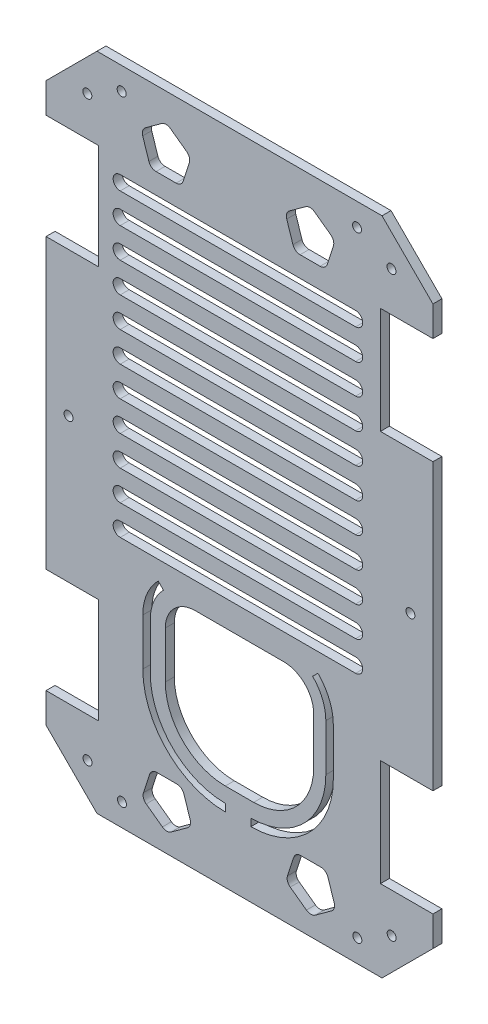
from build123d import *

# Parameters (mm, degrees)
SKETCH1_R           = 3
BOSS_EXTRUDE1_DEPTH = 6


with BuildPart() as part:
    # Sketch1 → Boss-Extrude1 (new body)
    with BuildSketch(Plane.XY):
        Polygon((-95, 220), (-128.941125497, 186.058874503), (-128.941125497, 166.058874503), (-93.941125497, 166.058874503), (-93.941125497, 96.058874503), (-128.941125497, 96.058874503), (-128.941125497, -96.058874503), (-93.941125497, -96.058874503), (-93.941125497, -166.058874503), (-128.941125497, -166.058874503), (-128.941125497, -186.058874503), (-95, -220), (95, -220), (128.941125497, -186.058874503), (128.941125497, -166.058874503), (93.941125497, -166.058874503), (93.941125497, -95), (128.941125497, -95), (128.941125497, 95), (93.941125497, 95), (93.941125497, 166.058874503), (128.941125497, 166.058874503), (128.941125497, 186.058874503), (95, 220), align=None)
        with Locations((-101.293979907, -192.492816657)):
            Circle(SKETCH1_R, mode=Mode.SUBTRACT)
        with Locations((-78.553968254, 205)):
            Circle(SKETCH1_R, mode=Mode.SUBTRACT)
        with Locations((-113.941125497, 0)):
            Circle(SKETCH1_R, mode=Mode.SUBTRACT)
        with Locations((-78.346031746, -205)):
            Circle(SKETCH1_R, mode=Mode.SUBTRACT)
        with Locations((78.553968254, -205)):
            Circle(SKETCH1_R, mode=Mode.SUBTRACT)
        with Locations((101.433942154, -192.35285441)):
            Circle(SKETCH1_R, mode=Mode.SUBTRACT)
        with Locations((113.941125497, 0)):
            Circle(SKETCH1_R, mode=Mode.SUBTRACT)
        with Locations((101.293979907, 192.492816657)):
            Circle(SKETCH1_R, mode=Mode.SUBTRACT)
        with Locations((78.346031746, 205)):
            Circle(SKETCH1_R, mode=Mode.SUBTRACT)
        with Locations((-101.433942154, 192.35285441)):
            Circle(SKETCH1_R, mode=Mode.SUBTRACT)
        with BuildLine():
            Line((-29.457020152, -70.183029421), (29.457020152, -70.183029421))
            ThreePointArc((29.457020152, -70.183029421), (43.599155776, -76.040893798), (49.457020152, -90.183029421))
            Line((49.457020152, -90.183029421), (49.457020152, -121.389619945))
            ThreePointArc((49.457020152, -121.389619945), (37.741291399, -149.673891193), (9.457020152, -161.389619945))
            Line((9.457020152, -161.389619945), (-9.457020152, -161.389619945))
            ThreePointArc((-9.457020152, -161.389619945), (-37.741291399, -149.673891193), (-49.457020152, -121.389619945))
            Line((-49.457020152, -121.389619945), (-49.457020152, -90.183029421))
            ThreePointArc((-49.457020152, -90.183029421), (-43.599155776, -76.040893798), (-29.457020152, -70.183029421))
        make_face(mode=Mode.SUBTRACT)
        with BuildLine():
            Line((-79.510988406, 156.534997535), (77.389011594, 156.534997535))
            ThreePointArc((77.389011594, 156.534997535), (82.10898008, 151.81502905), (77.389011594, 147.095060565))
            Line((77.389011594, 147.095060565), (-79.510988406, 147.095060565))
            ThreePointArc((-79.510988406, 147.095060565), (-84.230956891, 151.81502905), (-79.510988406, 156.534997535))
        make_face(mode=Mode.SUBTRACT)
        with BuildLine():
            Line((-79.510988406, 136.534997535), (77.389011594, 136.534997535))
            ThreePointArc((77.389011594, 136.534997535), (82.10898008, 131.81502905), (77.389011594, 127.095060565))
            Line((77.389011594, 127.095060565), (-79.510988406, 127.095060565))
            ThreePointArc((-79.510988406, 127.095060565), (-84.230956891, 131.81502905), (-79.510988406, 136.534997535))
        make_face(mode=Mode.SUBTRACT)
        with BuildLine():
            Line((-79.510988406, 116.534997535), (77.389011594, 116.534997535))
            ThreePointArc((77.389011594, 116.534997535), (82.10898008, 111.81502905), (77.389011594, 107.095060565))
            Line((77.389011594, 107.095060565), (-79.510988406, 107.095060565))
            ThreePointArc((-79.510988406, 107.095060565), (-84.230956891, 111.81502905), (-79.510988406, 116.534997535))
        make_face(mode=Mode.SUBTRACT)
        with BuildLine():
            Line((-79.510988406, 96.534997535), (77.389011594, 96.534997535))
            ThreePointArc((77.389011594, 96.534997535), (82.10898008, 91.81502905), (77.389011594, 87.095060565))
            Line((77.389011594, 87.095060565), (-79.510988406, 87.095060565))
            ThreePointArc((-79.510988406, 87.095060565), (-84.230956891, 91.81502905), (-79.510988406, 96.534997535))
        make_face(mode=Mode.SUBTRACT)
        with BuildLine():
            Line((-79.510988406, 76.534997535), (77.389011594, 76.534997535))
            ThreePointArc((77.389011594, 76.534997535), (82.10898008, 71.81502905), (77.389011594, 67.095060565))
            Line((77.389011594, 67.095060565), (-79.510988406, 67.095060565))
            ThreePointArc((-79.510988406, 67.095060565), (-84.230956891, 71.81502905), (-79.510988406, 76.534997535))
        make_face(mode=Mode.SUBTRACT)
        with BuildLine():
            Line((-45.51809389, -205.976815143), (-34.718467436, -198.130427238))
            ThreePointArc((-34.718467436, -198.130427238), (-32.902111116, -195.630427238), (-32.902111116, -192.540257294))
            Line((-32.902111116, -192.540257294), (-37.027201356, -179.844534973))
            ThreePointArc((-37.027201356, -179.844534973), (-38.843557676, -177.344534973), (-41.782483937, -176.389619945))
            Line((-41.782483937, -176.389619945), (-55.131556367, -176.389619945))
            ThreePointArc((-55.131556367, -176.389619945), (-58.070482628, -177.344534973), (-59.886838948, -179.844534973))
            Line((-59.886838948, -179.844534973), (-64.011929188, -192.540257294))
            ThreePointArc((-64.011929188, -192.540257294), (-64.011929188, -195.630427238), (-62.195572868, -198.130427238))
            Line((-62.195572868, -198.130427238), (-51.395946413, -205.976815143))
            ThreePointArc((-51.395946413, -205.976815143), (-48.457020152, -206.931730171), (-45.51809389, -205.976815143))
        make_face(mode=Mode.SUBTRACT)
        with BuildLine():
            Line((61.281532564, -198.130427238), (50.48190611, -205.976815143))
            ThreePointArc((50.48190611, -205.976815143), (47.542979848, -206.931730171), (44.604053587, -205.976815143))
            Line((44.604053587, -205.976815143), (33.804427132, -198.130427238))
            ThreePointArc((33.804427132, -198.130427238), (31.988070812, -195.630427238), (31.988070812, -192.540257294))
            Line((31.988070812, -192.540257294), (36.113161052, -179.844534973))
            ThreePointArc((36.113161052, -179.844534973), (37.929517372, -177.344534973), (40.868443633, -176.389619945))
            Line((40.868443633, -176.389619945), (54.217516063, -176.389619945))
            ThreePointArc((54.217516063, -176.389619945), (57.156442324, -177.344534973), (58.972798644, -179.844534973))
            Line((58.972798644, -179.844534973), (63.097888884, -192.540257294))
            ThreePointArc((63.097888884, -192.540257294), (63.097888884, -195.630427238), (61.281532564, -198.130427238))
        make_face(mode=Mode.SUBTRACT)
        with BuildLine():
            Line((-79.510988406, 56.534997535), (77.389011594, 56.534997535))
            ThreePointArc((77.389011594, 56.534997535), (82.10898008, 51.81502905), (77.389011594, 47.095060565))
            Line((77.389011594, 47.095060565), (-79.510988406, 47.095060565))
            ThreePointArc((-79.510988406, 47.095060565), (-84.230956891, 51.81502905), (-79.510988406, 56.534997535))
        make_face(mode=Mode.SUBTRACT)
        with BuildLine():
            Line((-79.510988406, 36.534997535), (77.389011594, 36.534997535))
            ThreePointArc((77.389011594, 36.534997535), (82.10898008, 31.81502905), (77.389011594, 27.095060565))
            Line((77.389011594, 27.095060565), (-79.510988406, 27.095060565))
            ThreePointArc((-79.510988406, 27.095060565), (-84.230956891, 31.81502905), (-79.510988406, 36.534997535))
        make_face(mode=Mode.SUBTRACT)
        with BuildLine():
            Line((-79.510988406, 16.534997535), (77.389011594, 16.534997535))
            ThreePointArc((77.389011594, 16.534997535), (82.10898008, 11.81502905), (77.389011594, 7.095060565))
            Line((77.389011594, 7.095060565), (-79.510988406, 7.095060565))
            ThreePointArc((-79.510988406, 7.095060565), (-84.230956891, 11.81502905), (-79.510988406, 16.534997535))
        make_face(mode=Mode.SUBTRACT)
        with BuildLine():
            Line((44.104053587, 199.809790591), (33.304427132, 191.963402686))
            ThreePointArc((33.304427132, 191.963402686), (31.488070812, 189.463402686), (31.488070812, 186.373232742))
            Line((31.488070812, 186.373232742), (35.613161052, 173.677510421))
            ThreePointArc((35.613161052, 173.677510421), (37.429517372, 171.177510421), (40.368443633, 170.222595393))
            Line((40.368443633, 170.222595393), (53.717516063, 170.222595393))
            ThreePointArc((53.717516063, 170.222595393), (56.656442324, 171.177510421), (58.472798644, 173.677510421))
            Line((58.472798644, 173.677510421), (62.597888884, 186.373232742))
            ThreePointArc((62.597888884, 186.373232742), (62.597888884, 189.463402686), (60.781532564, 191.963402686))
            Line((60.781532564, 191.963402686), (49.98190611, 199.809790591))
            ThreePointArc((49.98190611, 199.809790591), (47.042979848, 200.764705619), (44.104053587, 199.809790591))
        make_face(mode=Mode.SUBTRACT)
        with BuildLine():
            Line((-62.695572868, 191.963402686), (-51.895946413, 199.809790591))
            ThreePointArc((-51.895946413, 199.809790591), (-48.957020152, 200.764705619), (-46.01809389, 199.809790591))
            Line((-46.01809389, 199.809790591), (-35.218467436, 191.963402686))
            ThreePointArc((-35.218467436, 191.963402686), (-33.402111116, 189.463402686), (-33.402111116, 186.373232742))
            Line((-33.402111116, 186.373232742), (-37.527201356, 173.677510421))
            ThreePointArc((-37.527201356, 173.677510421), (-39.343557676, 171.177510421), (-42.282483937, 170.222595393))
            Line((-42.282483937, 170.222595393), (-55.631556367, 170.222595393))
            ThreePointArc((-55.631556367, 170.222595393), (-58.570482628, 171.177510421), (-60.386838948, 173.677510421))
            Line((-60.386838948, 173.677510421), (-64.511929188, 186.373232742))
            ThreePointArc((-64.511929188, 186.373232742), (-64.511929188, 189.463402686), (-62.695572868, 191.963402686))
        make_face(mode=Mode.SUBTRACT)
        with BuildLine():
            Line((-79.510988406, -3.465002465), (77.389011594, -3.465002465))
            ThreePointArc((77.389011594, -3.465002465), (82.10898008, -8.18497095), (77.389011594, -12.904939435))
            Line((77.389011594, -12.904939435), (-79.510988406, -12.904939435))
            ThreePointArc((-79.510988406, -12.904939435), (-84.230956891, -8.18497095), (-79.510988406, -3.465002465))
        make_face(mode=Mode.SUBTRACT)
        with BuildLine():
            Line((-79.510988406, -23.465002465), (77.389011594, -23.465002465))
            ThreePointArc((77.389011594, -23.465002465), (82.10898008, -28.18497095), (77.389011594, -32.904939435))
            Line((77.389011594, -32.904939435), (-79.510988406, -32.904939435))
            ThreePointArc((-79.510988406, -32.904939435), (-84.230956891, -28.18497095), (-79.510988406, -23.465002465))
        make_face(mode=Mode.SUBTRACT)
        with BuildLine():
            Line((-79.510988406, -43.465002465), (77.389011594, -43.465002465))
            ThreePointArc((77.389011594, -43.465002465), (82.10898008, -48.18497095), (77.389011594, -52.904939435))
            Line((77.389011594, -52.904939435), (-79.510988406, -52.904939435))
            ThreePointArc((-79.510988406, -52.904939435), (-84.230956891, -48.18497095), (-79.510988406, -43.465002465))
        make_face(mode=Mode.SUBTRACT)
        with BuildLine():
            Line((-59.457020152, -90.183029421), (-59.457020152, -121.389619945))
            ThreePointArc((-59.457020152, -121.389619945), (-44.812359211, -156.744959005), (-9.457020152, -171.389619945))
            Line((-9.457020152, -171.389619945), (-9.457020152, -176.389619945))
            ThreePointArc((-9.457020152, -176.389619945), (-48.347893117, -160.280492911), (-64.457020152, -121.389619945))
            Line((-64.457020152, -121.389619945), (-64.457020152, -90.183029421))
            ThreePointArc((-64.457020152, -90.183029421), (-61.79280379, -76.789109289), (-54.205757493, -65.43429208))
            Line((-54.205757493, -65.43429208), (-50.670223587, -68.969825986))
            ThreePointArc((-50.670223587, -68.969825986), (-57.173406127, -78.70252645), (-59.457020152, -90.183029421))
        make_face(mode=Mode.SUBTRACT)
        with BuildLine():
            Line((48.756183284, -68.969825986), (52.29171719, -65.43429208))
            ThreePointArc((52.29171719, -65.43429208), (59.878763486, -76.789109289), (62.542979848, -90.183029421))
            Line((62.542979848, -90.183029421), (62.542979848, -121.389619945))
            ThreePointArc((62.542979848, -121.389619945), (46.433852813, -160.280492911), (7.542979848, -176.389619945))
            Line((7.542979848, -176.389619945), (7.542979848, -171.389619945))
            ThreePointArc((7.542979848, -171.389619945), (42.898318907, -156.744959005), (57.542979848, -121.389619945))
            Line((57.542979848, -121.389619945), (57.542979848, -90.183029421))
            ThreePointArc((57.542979848, -90.183029421), (55.259365823, -78.70252645), (48.756183284, -68.969825986))
        make_face(mode=Mode.SUBTRACT)
    extrude(amount=BOSS_EXTRUDE1_DEPTH)


solid = part.part
